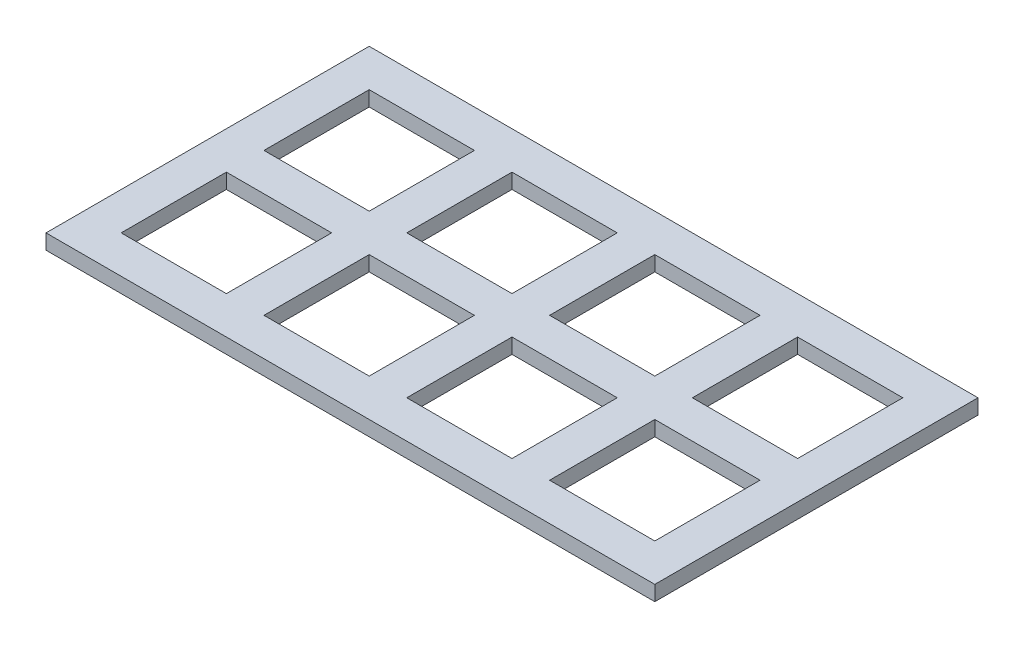
from build123d import *

# Parameters (mm, degrees)
SKETCH1_W           = 14
SKETCH1_H           = 14
BOSS_EXTRUDE1_DEPTH = 2


with BuildPart() as part:
    # Sketch1 → Boss-Extrude1 (new body)
    with BuildSketch(Plane(origin=(0, 0, 0), x_dir=(1, 0, 0), z_dir=(0, 1, 0))):
        Polygon((-40.5, 21.5), (40.5, 21.5), (40.5, 16.5), (40.5, 0), (40.5, -16.5), (40.5, -21.5), (-40.5, -21.5), (-40.5, -16.5), (-40.5, 16.5), align=None)
        with Locations((28.5, 9.5)):
            Rectangle(SKETCH1_W, SKETCH1_H, mode=Mode.SUBTRACT)
        with Locations((9.5, 9.5)):
            Rectangle(SKETCH1_W, SKETCH1_H, mode=Mode.SUBTRACT)
        with Locations((-28.5, 9.5)):
            Rectangle(SKETCH1_W, SKETCH1_H, mode=Mode.SUBTRACT)
        with Locations((-9.5, 9.5)):
            Rectangle(SKETCH1_W, SKETCH1_H, mode=Mode.SUBTRACT)
        with Locations((-28.5, -9.5)):
            Rectangle(SKETCH1_W, SKETCH1_H, mode=Mode.SUBTRACT)
        with Locations((-9.5, -9.5)):
            Rectangle(SKETCH1_W, SKETCH1_H, mode=Mode.SUBTRACT)
        with Locations((28.5, -9.5)):
            Rectangle(SKETCH1_W, SKETCH1_H, mode=Mode.SUBTRACT)
        with Locations((9.5, -9.5)):
            Rectangle(SKETCH1_W, SKETCH1_H, mode=Mode.SUBTRACT)
    extrude(amount=BOSS_EXTRUDE1_DEPTH)


solid = part.part
